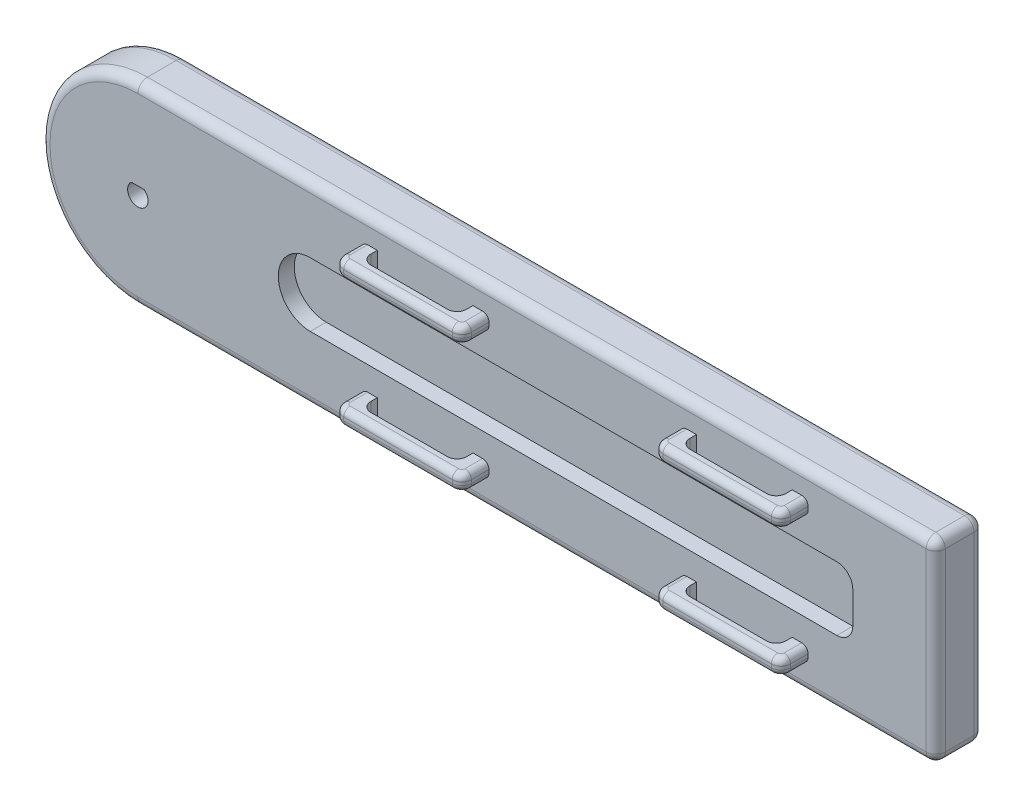
from build123d import *

# Parameters (mm, degrees)
BOSS_EXTRUDE1_DEPTH               = 15
CONG_2_R                          = 3
ENL_V_MAT_EXTRU_3_DEPTH           = 10
BOSS_EXTRU_1_DEPTH                = 5
CONG_3_R                          = 3
CONG_4_R                          = 3
R_P_TITION_LIN_AIRE1_COUNT        = 2
R_P_TITION_LIN_AIRE1_PITCH        = 100
R_P_TITION_LIN_AIRE2_COUNT        = 2
R_P_TITION_LIN_AIRE2_PITCH        = 40
R_P_TITION_LIN_AIRE2_COPY_1_DEPTH = 5
CONG_5_R                          = 3
CONG_6_R                          = 3
CONG_7_R                          = 3
CONG_8_R                          = 2
ENL_V_MAT_EXTRU_5_DEPTH           = 5
CONG_10_R                         = 5


with BuildPart() as part:
    # Sketch1 → Boss-Extrude1 (new body)
    with BuildSketch(Plane.XY):
        with BuildLine():
            Line((0, 30.56), (250, 30.56))
            Line((250, 30.56), (250, -30.56))
            Line((250, -30.56), (0, -30.56))
            ThreePointArc((0, -30.56), (-30.56, 0), (0, 30.56))
        make_face()
    extrude(amount=BOSS_EXTRUDE1_DEPTH)

    # Congé2
    cong_2_edges = [part.edges().sort_by_distance(p)[0] for p in [
        (250, 0, 15),
        (125, 30.56, 15),
        (-30.56, 0, 15),
        (125, 30.56, 0),
        (250, 0, 0),
        (125, -30.56, 0),
        (-30.56, 0, 0),
        (125, -30.56, 15),
        (250, 30.56, 7.5),
        (250, -30.56, 7.5),
    ]]
    fillet(cong_2_edges, radius=CONG_2_R)

    # Esquisse5 → Enlèv. mat.-Extru.3 (cut)
    with BuildSketch(Plane.XY.offset(15)):
        with BuildLine():
            Line((-2.024287639, 2.522286838), (1.975712361, 2.522286838))
            ThreePointArc((1.975712361, 2.522286838), (-0.024287639, -3.175712361), (-2.024287639, 2.522286838))
        make_face()
    extrude(amount=-ENL_V_MAT_EXTRU_3_DEPTH, mode=Mode.SUBTRACT)

    # Esquisse9 → Boss.-Extru.1 (add)
    with BuildSketch(Plane(origin=(0, 22.56, 0), x_dir=(1, 0, 0), z_dir=(0, 1, 0))):
        Polygon((70, -15), (70, -23.5), (110, -23.5), (110, -15), (105, -15), (105, -20), (75, -20), (75, -15), align=None)
    boss_extru_1 = extrude(amount=-BOSS_EXTRU_1_DEPTH)

    # Congé3
    cong_3_edges = [part.edges().sort_by_distance(p)[0] for p in [
        (70, 20.06, 23.5),
    ]]
    fillet(cong_3_edges, radius=CONG_3_R)

    # Congé4
    cong_4_edges = [part.edges().sort_by_distance(p)[0] for p in [
        (75, 20.06, 20),
        (105, 20.06, 20),
        (110, 20.06, 23.5),
    ]]
    fillet(cong_4_edges, radius=CONG_4_R)

    # Répétition linéaire1: Boss.-Extru.1 ×2
    with Locations(*[(i * R_P_TITION_LIN_AIRE1_PITCH, 0, 0) for i in range(1, R_P_TITION_LIN_AIRE1_COUNT)]):
        add(boss_extru_1)

    # Répétition linéaire2: Boss.-Extru.1 ×2
    with Locations(*[(0, -i * R_P_TITION_LIN_AIRE2_PITCH, 0) for i in range(1, R_P_TITION_LIN_AIRE2_COUNT)]):
        add(boss_extru_1)

    # Répétition linéaire2 copy 1 sketch → Répétition linéaire2 copy 1 (add)
    with BuildSketch(Plane(origin=(100, -17.44, 0), x_dir=(1, 0, 0), z_dir=(0, 1, 0))):
        Polygon((70, -15), (70, -23.5), (110, -23.5), (110, -15), (105, -15), (105, -20), (75, -20), (75, -15), align=None)
    extrude(amount=-R_P_TITION_LIN_AIRE2_COPY_1_DEPTH)

    # Congé5
    cong_5_edges = [part.edges().sort_by_distance(p)[0] for p in [
        (75, -19.94, 20),
        (105, -19.94, 20),
        (110, -19.94, 23.5),
        (70, -19.94, 23.5),
    ]]
    fillet(cong_5_edges, radius=CONG_5_R)

    # Congé6
    cong_6_edges = [part.edges().sort_by_distance(p)[0] for p in [
        (175, -19.94, 20),
        (205, -19.94, 20),
        (210, -19.94, 23.5),
        (170, -19.94, 23.5),
    ]]
    fillet(cong_6_edges, radius=CONG_6_R)

    # Congé7
    cong_7_edges = [part.edges().sort_by_distance(p)[0] for p in [
        (175, 20.06, 20),
        (205, 20.06, 20),
        (210, 20.06, 23.5),
        (170, 20.06, 23.5),
    ]]
    fillet(cong_7_edges, radius=CONG_7_R)

    # Congé8
    cong_8_edges = [part.edges().sort_by_distance(p)[0] for p in [
        (170, 17.56, 17.75),
        (170, 22.56, 17.75),
        (70, -22.44, 17.75),
        (70, -17.44, 17.75),
        (170, -22.44, 17.75),
        (170, -17.44, 17.75),
        (90, -17.44, 23.5),
        (110, -17.44, 17.75),
        (109.121320344, -17.44, 22.621320344),
        (70.878679656, -17.44, 22.621320344),
        (90, -22.44, 23.5),
        (110, -22.44, 17.75),
        (109.121320344, -22.44, 22.621320344),
        (70.878679656, -22.44, 22.621320344),
        (190, -17.44, 23.5),
        (190, -22.44, 23.5),
        (210, -17.44, 17.75),
        (170.878679656, -17.44, 22.621320344),
        (209.121320344, -17.44, 22.621320344),
        (210, -22.44, 17.75),
        (170.878679656, -22.44, 22.621320344),
        (209.121320344, -22.44, 22.621320344),
        (190, 22.56, 23.5),
        (210, 22.56, 17.75),
        (209.121320344, 22.56, 22.621320344),
        (170.878679656, 22.56, 22.621320344),
        (190, 17.56, 23.5),
        (210, 17.56, 17.75),
        (209.121320344, 17.56, 22.621320344),
        (170.878679656, 17.56, 22.621320344),
        (70, 17.56, 17.75),
        (70, 22.56, 17.75),
        (90, 22.56, 23.5),
        (70.878679656, 22.56, 22.621320344),
        (90, 17.56, 23.5),
        (70.878679656, 17.56, 22.621320344),
        (110, 22.56, 17.75),
        (109.121320344, 22.56, 22.621320344),
        (110, 17.56, 17.75),
        (109.121320344, 17.56, 22.621320344),
    ]]
    fillet(cong_8_edges, radius=CONG_8_R)

    # Esquisse11 → Enlèv. mat.-Extru.5 (cut)
    with BuildSketch(Plane.XY.offset(15)):
        with BuildLine():
            Line((54, 10.06), (224, 10.06))
            Line((224, 10.06), (224, -9.94))
            Line((224, -9.94), (54, -9.94))
            ThreePointArc((54, -9.94), (44, 0.06), (54, 10.06))
        make_face()
    extrude(amount=-ENL_V_MAT_EXTRU_5_DEPTH, mode=Mode.SUBTRACT)

    # Congé10
    cong_10_edges = [part.edges().sort_by_distance(p)[0] for p in [
        (224, 10.06, 12.5),
        (224, -9.94, 12.5),
    ]]
    fillet(cong_10_edges, radius=CONG_10_R)


solid = part.part
